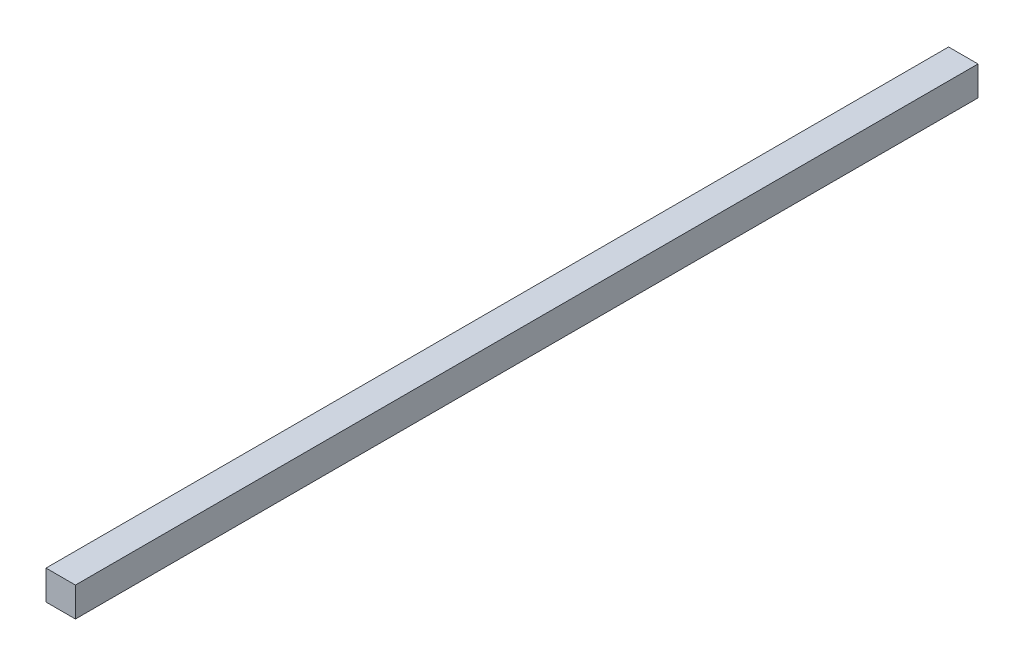
from build123d import *

# Parameters (mm, degrees)
SKETCH2_W           = 38.1
SKETCH2_H           = 38.1
BOSS_EXTRUDE1_DEPTH = 1168.4


with BuildPart() as part:
    # Sketch2 → Boss-Extrude1 (new body)
    with BuildSketch(Plane.XY):
        with Locations((0.261022148, 692.15)):
            Rectangle(SKETCH2_W, SKETCH2_H)
    extrude(amount=BOSS_EXTRUDE1_DEPTH)


solid = part.part
